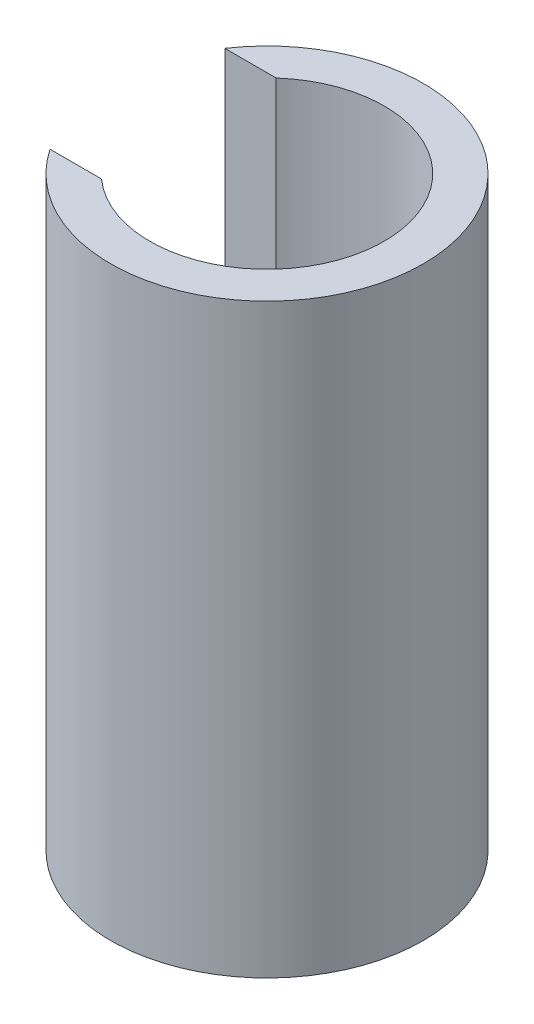
from build123d import *

# Parameters (mm, degrees)
SKETCH_1_R          = 4
SKETCH_1_R_2        = 3
EXTRUDE_1_DEPTH     = 15
SKETCH_2_W          = 2
SKETCH_2_H          = 4.472135954
CUT_EXTRUDE_1_DEPTH = 15


with BuildPart() as part:
    # 草圖1 → 填料-伸長1 (new body)
    with BuildSketch(Plane(origin=(0, 0, 0), x_dir=(1, 0, 0), z_dir=(0, 1, 0))):
        Circle(SKETCH_1_R)
        Circle(SKETCH_1_R_2, mode=Mode.SUBTRACT)
    extrude(amount=EXTRUDE_1_DEPTH)

    # 草圖2 → 除料-伸長1 (cut)
    with BuildSketch(Plane(origin=(0, 15, 0), x_dir=(1, 0, 0), z_dir=(0, 1, 0))):
        with Locations((-3, 0)):
            Rectangle(SKETCH_2_W, SKETCH_2_H)
    extrude(amount=-CUT_EXTRUDE_1_DEPTH, mode=Mode.SUBTRACT)


solid = part.part
